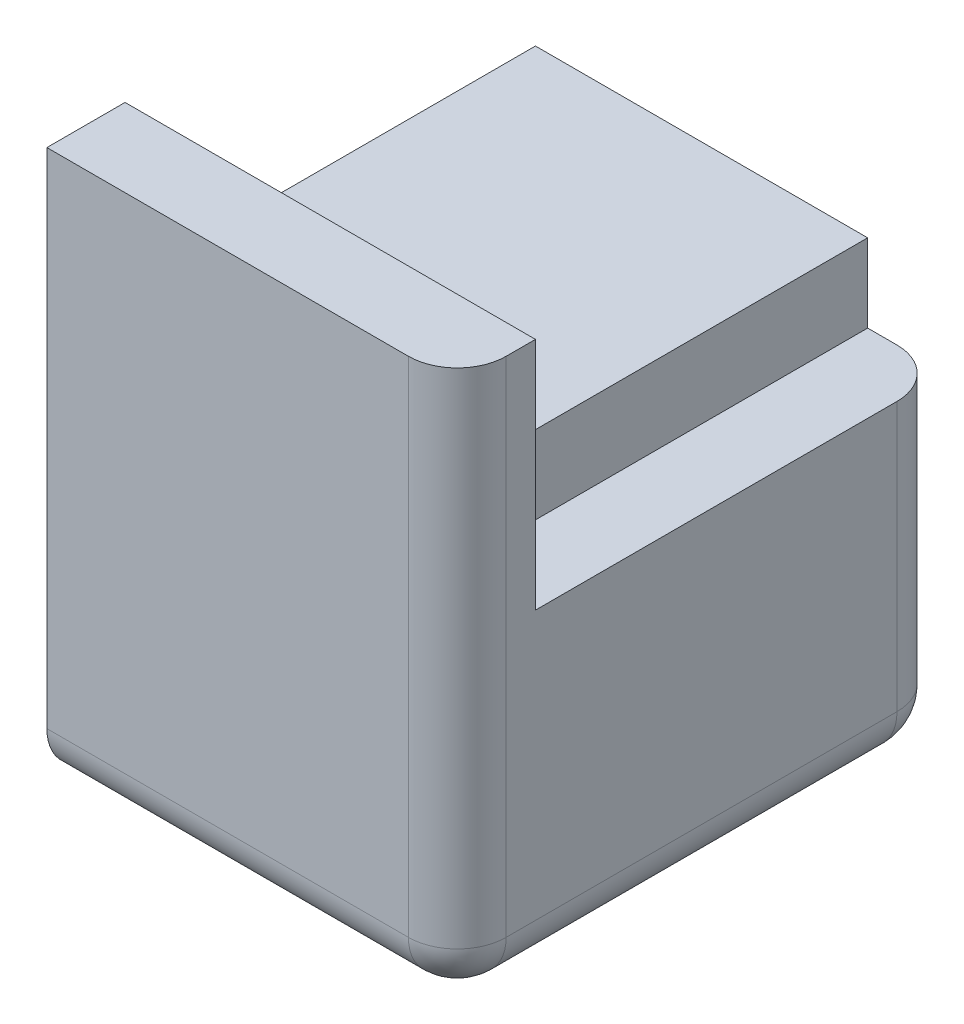
from build123d import *

# Parameters (mm, degrees)
SKETCH2_W                 = 8.4
SKETCH2_H                 = 10
BOSS_EXTRUDE1_DEPTH       = 11.3
SKETCH5_W                 = 8.4
SKETCH5_H                 = 1.5
CUT_EXTRUDE2_DEPTH        = 11.3
SKETCH7_W                 = 1.6
SKETCH7_H                 = 3.3
CUT_EXTRUDE4_DEPTH        = 8.4
SKETCH9_W                 = 8.4
SKETCH9_H                 = 1.7
CUT_EXTRUDE5_DEPTH        = 6.8
SKETCH12_W                = 6.8
SKETCH12_H                = 1.6
BOSS_EXTRUDE3_DEPTH       = 1.6
FILLET1_R                 = 1
M3X0_5_TAPPED_HOLE2_D     = 2.5
M3X0_5_TAPPED_HOLE2_DEPTH = 6.5
M3X0_5_TAPPED_HOLE2_TIP   = 0.751075774


with BuildPart() as part:
    # Sketch2 → Boss-Extrude1 (new body)
    with BuildSketch(Plane(origin=(0, 0, 0), x_dir=(1, 0, 0), z_dir=(0, 1, 0))):
        Rectangle(SKETCH2_W, SKETCH2_H)
    extrude(amount=BOSS_EXTRUDE1_DEPTH)

    # Sketch5 → Cut-Extrude2 (cut)
    with BuildSketch(Plane(origin=(4.2, 0, 0), x_dir=(0, 0, -1), z_dir=(1, 0, 0))):
        with Locations((0.8, 10.55)):
            Rectangle(SKETCH5_W, SKETCH5_H)
    extrude(amount=-CUT_EXTRUDE2_DEPTH, mode=Mode.SUBTRACT)

    # Sketch7 → Cut-Extrude4 (cut)
    with BuildSketch(Plane(origin=(0, 0, -5), x_dir=(-1, 0, 0), z_dir=(0, 0, -1))):
        with Locations((-3.4, 8.15)):
            Rectangle(SKETCH7_W, SKETCH7_H)
    extrude(amount=-CUT_EXTRUDE4_DEPTH, mode=Mode.SUBTRACT)

    # Sketch9 → Cut-Extrude5 (cut)
    with BuildSketch(Plane(origin=(2.6, 0, 0), x_dir=(0, 0, -1), z_dir=(1, 0, 0))):
        with Locations((0.8, 8.95)):
            Rectangle(SKETCH9_W, SKETCH9_H)
    extrude(amount=-CUT_EXTRUDE5_DEPTH, mode=Mode.SUBTRACT)

    # Sketch12 → Boss-Extrude3 (add)
    with BuildSketch(Plane(origin=(0, 0, 3.4), x_dir=(-1, 0, 0), z_dir=(0, 0, -1))):
        with Locations((0.8, 8.9)):
            Rectangle(SKETCH12_W, SKETCH12_H)
    extrude(amount=BOSS_EXTRUDE3_DEPTH)

    # Fillet1
    fillet1_edges = [part.edges().sort_by_distance(p)[0] for p in [
        (4.2, 3.25, -5),
        (0, 0, 5),
        (0, 0, -5),
        (4.2, 0, 0),
        (4.2, 5.65, 5),
    ]]
    fillet(fillet1_edges, radius=FILLET1_R)

    # M3x0.5 Tapped Hole2
    with Locations(Plane.ZY.offset(4.2)):
        with Locations((0, 5)):
            Hole(M3X0_5_TAPPED_HOLE2_D / 2, depth=M3X0_5_TAPPED_HOLE2_DEPTH)
            with Locations((0, 0, -(M3X0_5_TAPPED_HOLE2_DEPTH + M3X0_5_TAPPED_HOLE2_TIP / 2))):  # 118° drill point
                Cone(0, M3X0_5_TAPPED_HOLE2_D / 2, M3X0_5_TAPPED_HOLE2_TIP, mode=Mode.SUBTRACT)


solid = part.part
